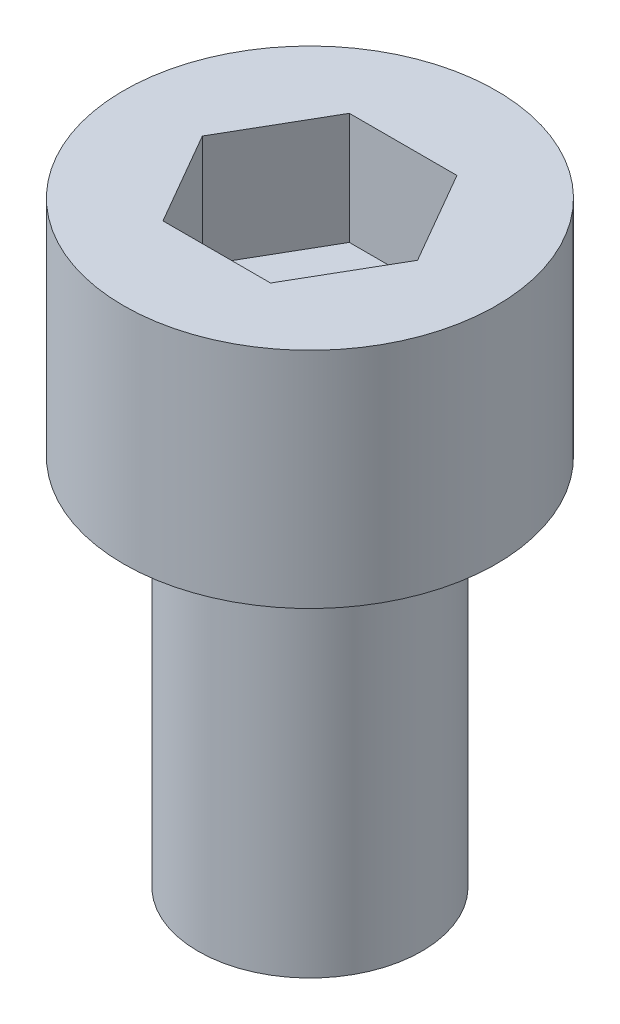
from build123d import *

# Parameters (mm, degrees)
CUT_EXTRUDE1_DEPTH = 3


with BuildPart() as part:
    # Sketch1 → Revolve1 (revolve)
    with BuildSketch(Plane.XY, mode=Mode.PRIVATE) as revolve1_sk:
        Polygon((0, -10), (3, -10), (3, 0), (5, 0), (5, 6), (0, 6), align=None)
    revolve(revolve1_sk.sketch.rotate(Axis((0, 61.691642626, 0), (0, -1, 0)), 90), axis=Axis((0, 61.691642626, 0), (0, -1, 0)))

    # Sketch2 → Cut-Extrude1 (cut)
    with BuildSketch(Plane(origin=(0, 6, 0), x_dir=(-1, 0, 0), z_dir=(0, 1, 0))):
        Polygon((-1.443375673, -2.5), (1.443375673, -2.5), (2.886751346, 0), (1.443375673, 2.5), (-1.443375673, 2.5), (-2.886751346, 0), align=None)
    extrude(amount=-CUT_EXTRUDE1_DEPTH, mode=Mode.SUBTRACT)


solid = part.part
